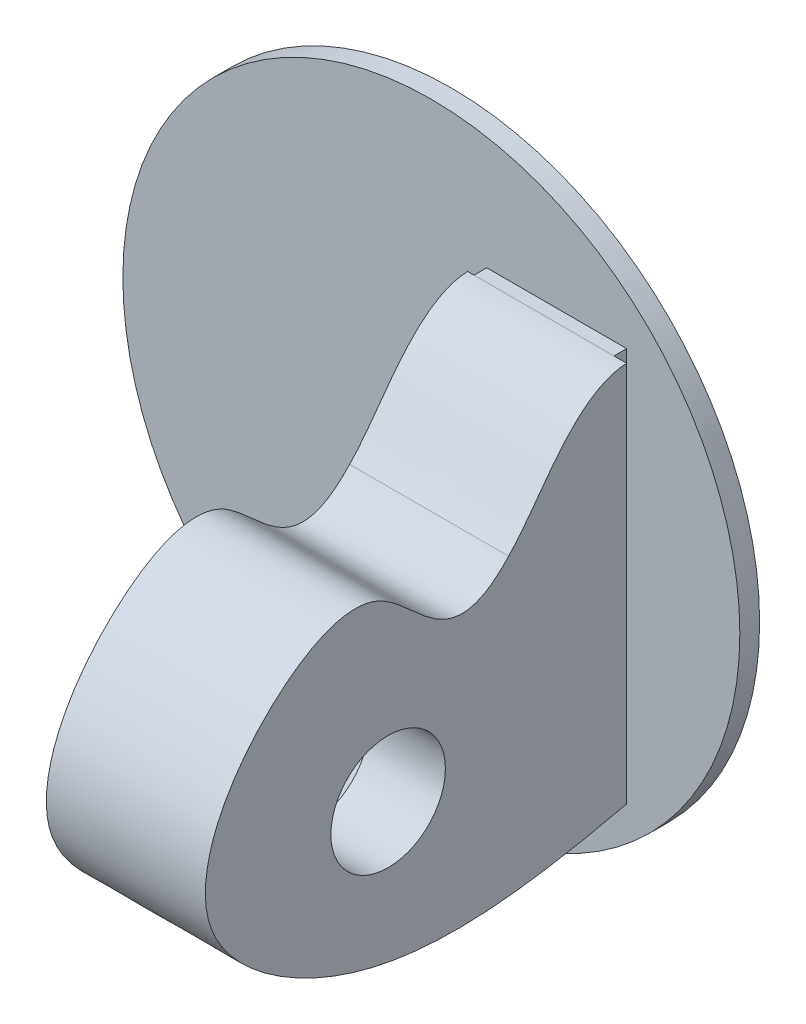
from build123d import *

# Parameters (mm, degrees)
SKETCH1_R                = 48.5
BOSS_EXTRUDE1_DEPTH      = 3.111281074
SKETCH2_W                = 22
SKETCH2_H                = 60
BOSS_EXTRUDE6_DEPTH      = 2
BOSS_EXTRUDE7_DEPTH      = 2
BOSS_EXTRUDE7_DEPTH_BACK = 23
SKETCH7_R                = 9
SKETCH7_W                = 41
SKETCH7_H                = 21
CUT_EXTRUDE5_DEPTH       = 13
SKETCH12_R               = 9
CUT_EXTRUDE6_DEPTH       = 14
SKETCH13_R               = 1.5
CUT_EXTRUDE7_DEPTH       = 10


with BuildPart() as part:
    # Sketch1 → Boss-Extrude1 (new body)
    with BuildSketch(Plane.XY):
        Circle(SKETCH1_R)
    extrude(amount=BOSS_EXTRUDE1_DEPTH)

    # Sketch2 → Boss-Extrude6 (add)
    with BuildSketch(Plane.XY.offset(3.111281074)):
        with Locations((19.70699147, -0.098262564)):
            Rectangle(SKETCH2_W, SKETCH2_H)
    extrude(amount=BOSS_EXTRUDE6_DEPTH)

    # Sketch6 → Boss-Extrude7 (add, two sides: drawn at the far end of the back side and taken through both)
    with BuildSketch(Plane(origin=(30.70699147, 0, 0), x_dir=(0, 0, -1), z_dir=(1, 0, 0)).offset(-BOSS_EXTRUDE7_DEPTH_BACK)):
        with BuildLine():
            Line((-5.111281074, -30.098262564), (-5.111281074, 29.901737436))
            add(Edge.make_bspline(
                [(-23.672790781, 12.918580112), (-19.019771768, 17.425385235), (-13.534645727, 29.591772181), (-5.111281074, 29.901737436)],
                knots=[0, 0, 0, 0, 0.927274153, 0.927274153, 0.927274153, 0.927274153], degree=3))
            add(Edge.make_bspline(
                [(-5.111281074, -30.098262564), (-21.067682827, -33.743624658), (-45.977074084, -37.934963998), (-77.014721166, -13.910764049), (-65.380576003, 10.485810573), (-41.897075437, 23.797763226), (-33.037636502, 2.78348011), (-23.672790781, 12.918580112)],
                knots=[0, 0, 0, 0, 0.360057927, 0.526916248, 0.718382939, 0.849564349, 1, 1, 1, 1], degree=3))
        make_face()
    extrude(amount=BOSS_EXTRUDE7_DEPTH + BOSS_EXTRUDE7_DEPTH_BACK)

    # Sketch7 → Cut-Extrude5 (cut)
    with BuildSketch(Plane.ZY.offset(-7.70699147)):
        with Locations((-46.721163339, -19.14114226)):
            Circle(SKETCH7_R)
        with Locations((31.95251948, -10.940784793)):
            Rectangle(SKETCH7_W, SKETCH7_H)
    extrude(amount=-CUT_EXTRUDE5_DEPTH, mode=Mode.SUBTRACT)

    # Sketch12 → Cut-Extrude6 (cut)
    with BuildSketch(Plane.ZY.offset(-20.70699147)):
        with Locations((42.612643274, -11.024756849)):
            Circle(SKETCH12_R)
    extrude(amount=-CUT_EXTRUDE6_DEPTH, mode=Mode.SUBTRACT)

    # Sketch13 → Cut-Extrude7 (cut)
    with BuildSketch(Plane.ZY.offset(-7.70699147)):
        with Locations((55.022708193, -6.353495735)):
            Circle(SKETCH13_R)
        with Locations((55.022708193, -15.353495735)):
            Circle(SKETCH13_R)
        with Locations((9.300403713, -6.353495735)):
            Circle(SKETCH13_R)
        with Locations((9.300403713, -15.353495735)):
            Circle(SKETCH13_R)
    extrude(amount=-CUT_EXTRUDE7_DEPTH, mode=Mode.SUBTRACT)


solid = part.part
